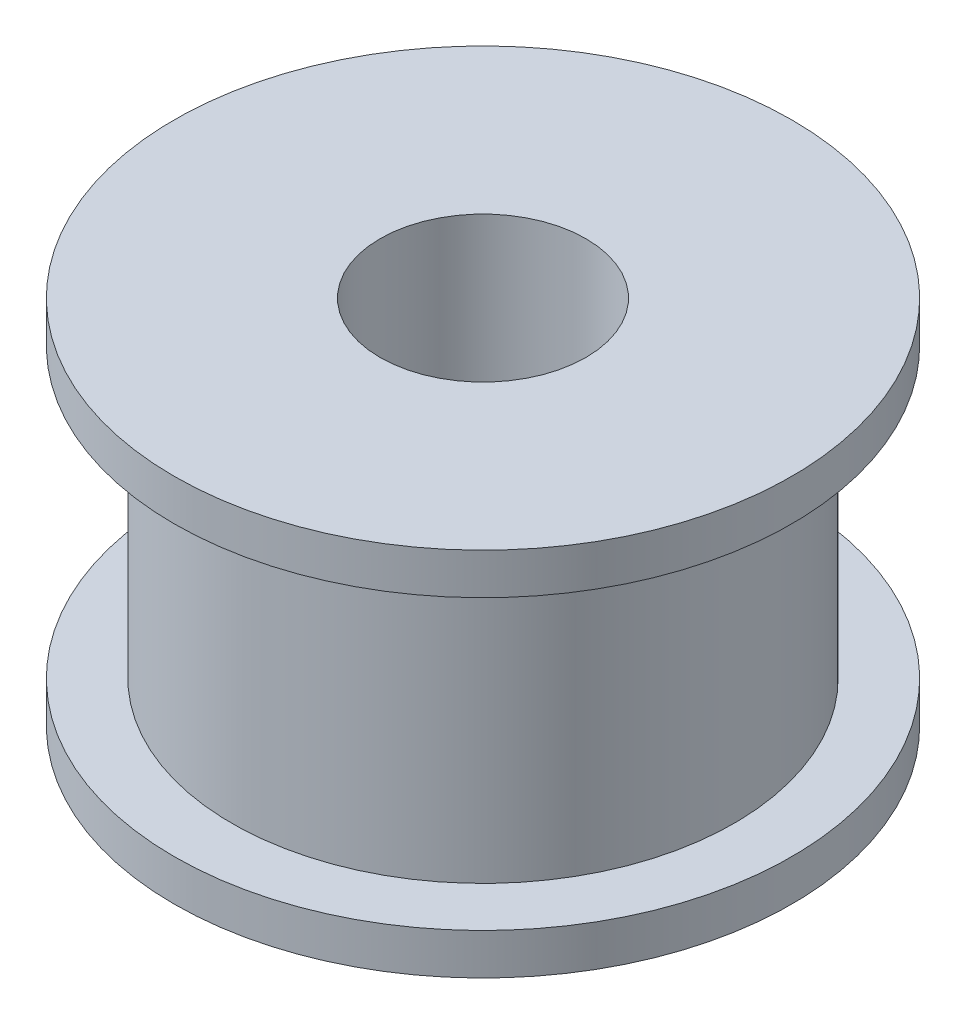
from build123d import *

# Parameters (mm, degrees)
SKETCH2_R          = 2.5
CUT_EXTRUDE1_DEPTH = 10


with BuildPart() as part:
    # Sketch1 → Revolve1 (revolve)
    with BuildSketch(Plane.XY, mode=Mode.PRIVATE) as revolve1_sk:
        Polygon((0, 0), (7.5, 0), (7.5, -1), (6.1, -1), (6.1, -8), (7.5, -8), (7.5, -9), (0, -9), align=None)
    revolve(revolve1_sk.sketch.rotate(Axis((0, 3.04, 0), (0, 1, 0)), 90), axis=Axis((0, 3.04, 0), (0, 1, 0)))

    # Sketch2 → Cut-Extrude1 (cut)
    with BuildSketch(Plane(origin=(0, 0, 0), x_dir=(1, 0, 0), z_dir=(0, 1, 0))):
        with Locations(Location((0, 0, 0), (0, 0, 270))):
            Circle(SKETCH2_R)
    extrude(amount=-CUT_EXTRUDE1_DEPTH, mode=Mode.SUBTRACT)


solid = part.part
